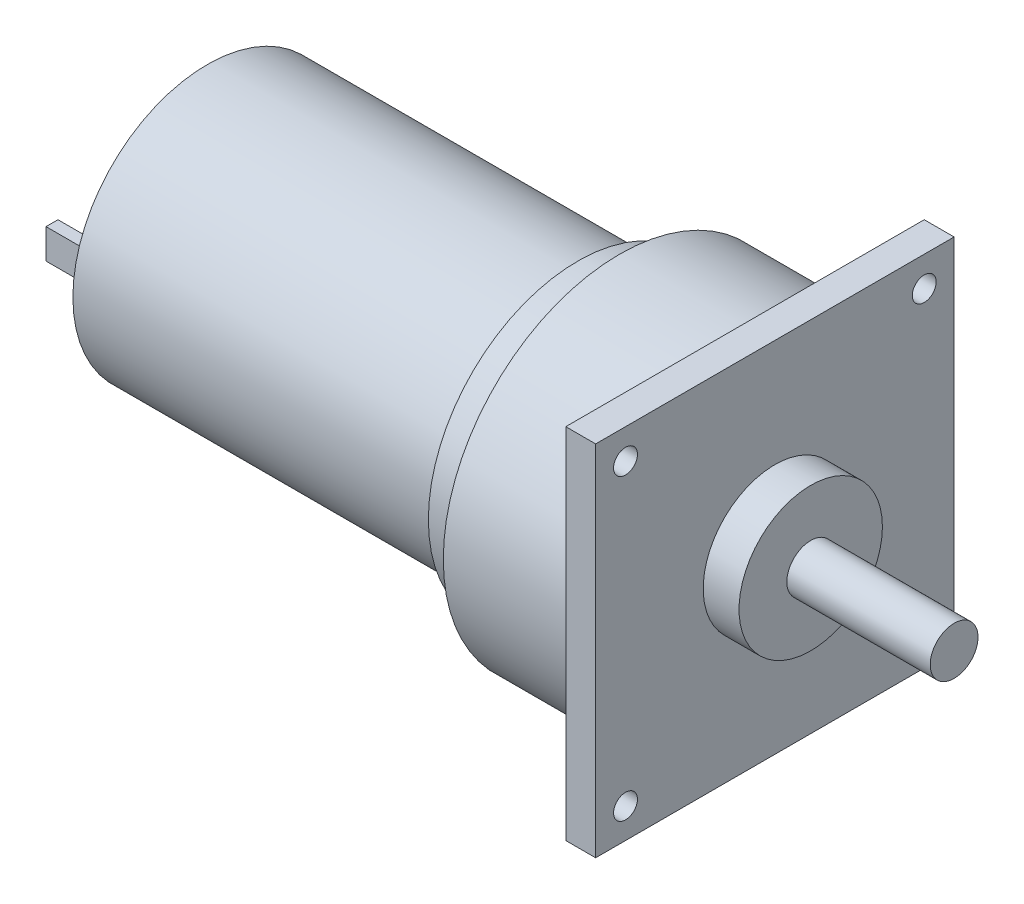
from build123d import *

# Parameters (mm, degrees)
SKETCH1_W           = 60
SKETCH1_H           = 60
BOSS_EXTRUDE1_DEPTH = 5
SKETCH3_R           = 29.5
BOSS_EXTRUDE2_DEPTH = 21
SKETCH4_R           = 25
BOSS_EXTRUDE3_DEPTH = 7
SKETCH5_R           = 22.5
BOSS_EXTRUDE4_DEPTH = 62
CUT_EXTRUDE1_REACH  = 106.043
SKETCH6_R           = 2
SKETCH7_R           = 12
BOSS_EXTRUDE5_DEPTH = 6
BOSS_EXTRUDE6_START = -6
SKETCH8_R           = 4
BOSS_EXTRUDE6_DEPTH = 30
SKETCH9_R           = 2.5
SKETCH9_W           = 2
SKETCH9_H           = 5
BOSS_EXTRUDE7_DEPTH = 10


with BuildPart() as part:
    # Sketch1 → Boss-Extrude1 (new body)
    with BuildSketch(Plane(origin=(0, 0, 0), x_dir=(0, 0, -1), z_dir=(1, 0, 0))):
        Rectangle(SKETCH1_W, SKETCH1_H)
    extrude(amount=BOSS_EXTRUDE1_DEPTH)

    # Sketch3 → Boss-Extrude2 (add)
    with BuildSketch(Plane.ZY):
        with Locations(Location((0, 0, 0), (0, 0, 180))):
            Circle(SKETCH3_R)
    extrude(amount=BOSS_EXTRUDE2_DEPTH)

    # Sketch4 → Boss-Extrude3 (add)
    with BuildSketch(Plane.ZY.offset(21)):
        Circle(SKETCH4_R)
    extrude(amount=BOSS_EXTRUDE3_DEPTH)

    # Sketch5 → Boss-Extrude4 (add)
    with BuildSketch(Plane.ZY.offset(28)):
        Circle(SKETCH5_R)
    extrude(amount=BOSS_EXTRUDE4_DEPTH)

    # Sketch6 → Cut-Extrude1 (cut, up to next)
    with BuildSketch(Plane(origin=(5, 0, 0), x_dir=(0, 0, -1), z_dir=(1, 0, 0)), mode=Mode.PRIVATE) as cut_extrude1_sk1:
        with Locations((-25, 25)):
            Circle(SKETCH6_R)
    cut_extrude1_tool1 = extrude(cut_extrude1_sk1.sketch, amount=-CUT_EXTRUDE1_REACH, mode=Mode.PRIVATE) & part.part
    # Sketch6 → Cut-Extrude1 (cut, up to next)
    with BuildSketch(Plane(origin=(5, 0, 0), x_dir=(0, 0, -1), z_dir=(1, 0, 0)), mode=Mode.PRIVATE) as cut_extrude1_sk2:
        with Locations((25, 25)):
            Circle(SKETCH6_R)
    cut_extrude1_tool2 = extrude(cut_extrude1_sk2.sketch, amount=-CUT_EXTRUDE1_REACH, mode=Mode.PRIVATE) & part.part
    # Sketch6 → Cut-Extrude1 (cut, up to next)
    with BuildSketch(Plane(origin=(5, 0, 0), x_dir=(0, 0, -1), z_dir=(1, 0, 0)), mode=Mode.PRIVATE) as cut_extrude1_sk3:
        with Locations((25, -25)):
            Circle(SKETCH6_R)
    cut_extrude1_tool3 = extrude(cut_extrude1_sk3.sketch, amount=-CUT_EXTRUDE1_REACH, mode=Mode.PRIVATE) & part.part
    # Sketch6 → Cut-Extrude1 (cut, up to next)
    with BuildSketch(Plane(origin=(5, 0, 0), x_dir=(0, 0, -1), z_dir=(1, 0, 0)), mode=Mode.PRIVATE) as cut_extrude1_sk4:
        with Locations((-25, -25)):
            Circle(SKETCH6_R)
    cut_extrude1_tool4 = extrude(cut_extrude1_sk4.sketch, amount=-CUT_EXTRUDE1_REACH, mode=Mode.PRIVATE) & part.part
    add(cut_extrude1_tool1.solids().sort_by_distance((5, 25, 25))[0], mode=Mode.SUBTRACT)
    add(cut_extrude1_tool2.solids().sort_by_distance((5, 25, -25))[0], mode=Mode.SUBTRACT)
    add(cut_extrude1_tool3.solids().sort_by_distance((5, -25, -25))[0], mode=Mode.SUBTRACT)
    add(cut_extrude1_tool4.solids().sort_by_distance((5, -25, 25))[0], mode=Mode.SUBTRACT)

    # Sketch7 → Boss-Extrude5 (add)
    with BuildSketch(Plane(origin=(5, 0, 0), x_dir=(0, 0, -1), z_dir=(1, 0, 0))):
        Circle(SKETCH7_R)
    extrude(amount=BOSS_EXTRUDE5_DEPTH)

    # Sketch8 → Boss-Extrude6 (add)
    with BuildSketch(Plane(origin=(11, 0, 0), x_dir=(0, 0, -1), z_dir=(1, 0, 0)).offset(BOSS_EXTRUDE6_START)):
        Circle(SKETCH8_R)
    extrude(amount=BOSS_EXTRUDE6_DEPTH)

    # Sketch9 → Boss-Extrude7 (add)
    with BuildSketch(Plane.ZY.offset(90)):
        Circle(SKETCH9_R)
        with Locations((-16, 0)):
            Rectangle(SKETCH9_W, SKETCH9_H)
        with Locations((16, 0)):
            Rectangle(SKETCH9_W, SKETCH9_H)
    extrude(amount=BOSS_EXTRUDE7_DEPTH)


solid = part.part
